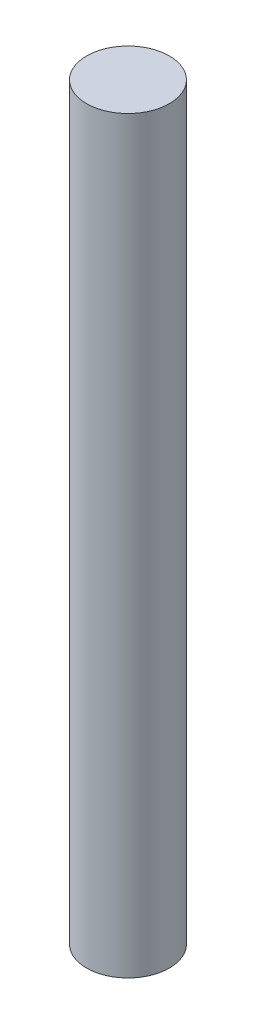
from build123d import *

# Parameters (mm, degrees)
SKETCH1_R           = 10.5
BOSS_EXTRUDE1_DEPTH = 190


with BuildPart() as part:
    # Sketch1 → Boss-Extrude1 (new body)
    with BuildSketch(Plane(origin=(0, 0, 0), x_dir=(1, 0, 0), z_dir=(0, 1, 0))):
        with Locations(Location((0, 0, 0), (0, 0, 270))):
            Circle(SKETCH1_R)
    extrude(amount=BOSS_EXTRUDE1_DEPTH)


solid = part.part
